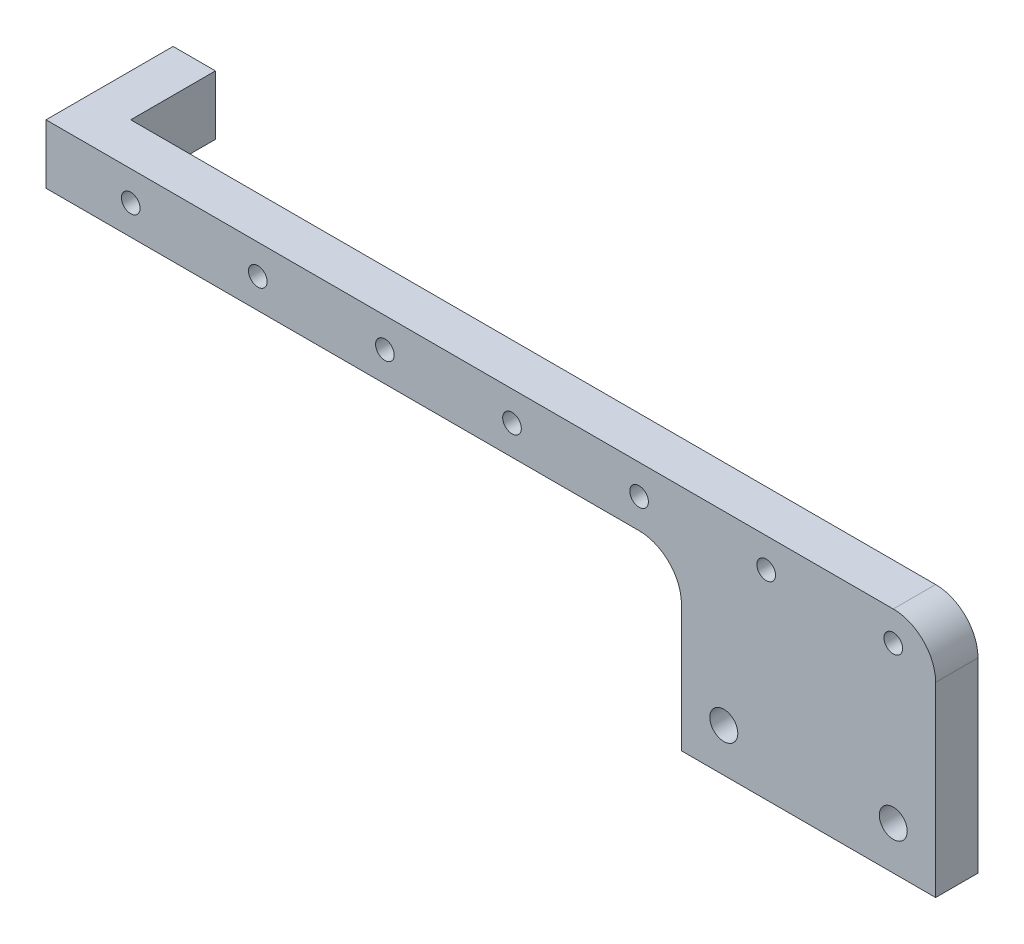
from build123d import *

# Parameters (mm, degrees)
SKETCH_1_W          = 100
SKETCH_1_H          = 7
EXTRUDE_1_DEPTH     = 5
SKETCH_2_R          = 1.1
CUT_EXTRUDE_1_DEPTH = 101.369318021
SKETCH_3_W          = 30
SKETCH_3_H          = 20
EXTRUDE_2_DEPTH     = 5
SKETCH_4_W          = 5
SKETCH_4_H          = 7
EXTRUDE_3_DEPTH     = 15
SKETCH_5_R          = 1.65
CUT_EXTRUDE_2_DEPTH = 15
FILLET_1_R          = 5


with BuildPart() as part:
    # 草图1 → 凸台-拉伸1 (new body)
    with BuildSketch(Plane.XY):
        with Locations((50, 3.5)):
            Rectangle(SKETCH_1_W, SKETCH_1_H)
    extrude(amount=EXTRUDE_1_DEPTH)

    # 草图2 → 切除-拉伸1 (cut, through all)
    with BuildSketch(Plane(origin=(0, 0, 0), x_dir=(-1, 0, 0), z_dir=(0, 0, -1))):
        with Locations((-95, 3.5)):
            Circle(SKETCH_2_R)
        with Locations((-80, 3.5)):
            Circle(SKETCH_2_R)
        with Locations((-65, 3.5)):
            Circle(SKETCH_2_R)
        with Locations((-50, 3.5)):
            Circle(SKETCH_2_R)
        with Locations((-35, 3.5)):
            Circle(SKETCH_2_R)
        with Locations((-20, 3.5)):
            Circle(SKETCH_2_R)
        with Locations((-5, 3.5)):
            Circle(SKETCH_2_R)
    extrude(amount=-CUT_EXTRUDE_1_DEPTH, mode=Mode.SUBTRACT)

    # 草图3 → 凸台-拉伸2 (add)
    with BuildSketch(Plane(origin=(0, 0, 0), x_dir=(-1, 0, 0), z_dir=(0, 0, -1))):
        with Locations((-85, -10)):
            Rectangle(SKETCH_3_W, SKETCH_3_H)
    extrude(amount=-EXTRUDE_2_DEPTH)

    # 草图4 → 凸台-拉伸3 (add)
    with BuildSketch(Plane.XY.offset(5)):
        with Locations((-2.5, 3.5)):
            Rectangle(SKETCH_4_W, SKETCH_4_H)
    extrude(amount=-EXTRUDE_3_DEPTH)

    # 草图5 → 切除-拉伸2 (cut)
    with BuildSketch(Plane(origin=(0, 0, 0), x_dir=(-1, 0, 0), z_dir=(0, 0, -1))):
        with Locations((-95, -14.9)):
            Circle(SKETCH_5_R)
        with Locations((-75, -14.9)):
            Circle(SKETCH_5_R)
    extrude(amount=-CUT_EXTRUDE_2_DEPTH, mode=Mode.SUBTRACT)

    # 圆角1
    fillet_1_edges = [part.edges().sort_by_distance(p)[0] for p in [
        (70, 0, 2.5),
        (100, 7, 2.5),
    ]]
    fillet(fillet_1_edges, radius=FILLET_1_R)


solid = part.part
